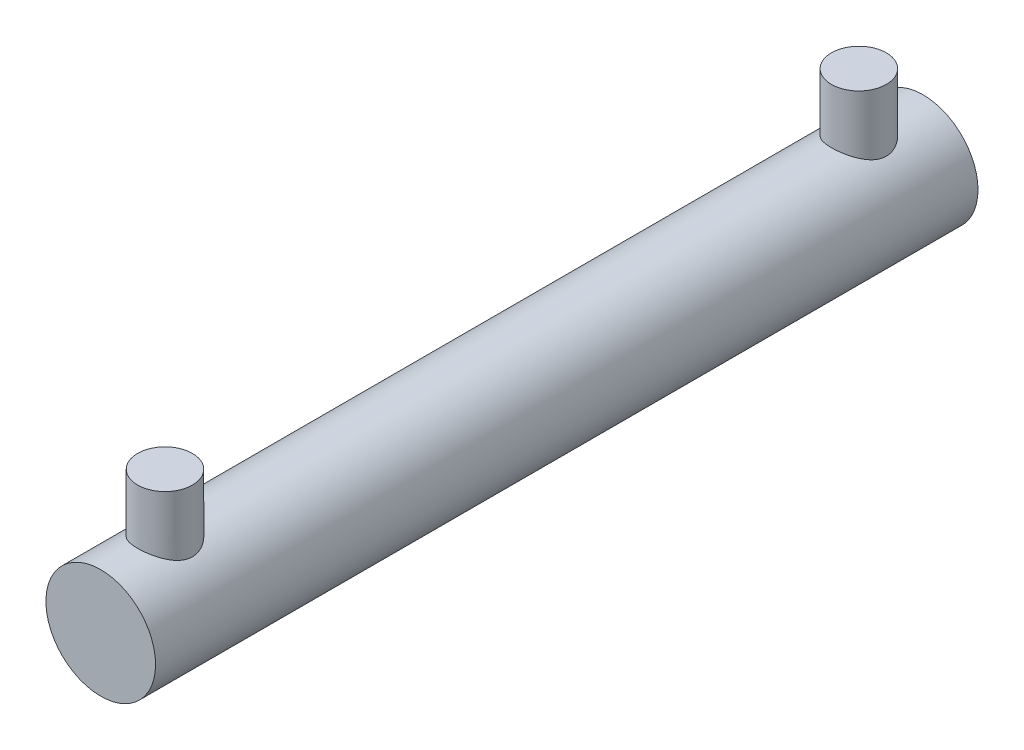
from build123d import *

# Parameters (mm, degrees)
SKETCH_1_R      = 20
EXTRUDE_1_DEPTH = 150
SKETCH_3_R      = 10
EXTRUDE_2_DEPTH = 40


with BuildPart() as part:
    # 草图1 → 凸台-拉伸1 (new, symmetric)
    with BuildSketch(Plane.XY):
        Circle(SKETCH_1_R)
    extrude(amount=EXTRUDE_1_DEPTH, both=True)

    # 草图3 → 凸台-拉伸2 (add)
    with BuildSketch(Plane(origin=(0, 0, 0), x_dir=(1, 0, 0), z_dir=(0, 1, 0))):
        with Locations(Location((0, 126.551526586, 0), (0, 0, 90))):
            Circle(SKETCH_3_R)
        with Locations(Location((0, -126.551526586, 0), (0, 0, 90))):
            Circle(SKETCH_3_R)
    extrude(amount=EXTRUDE_2_DEPTH)


solid = part.part
